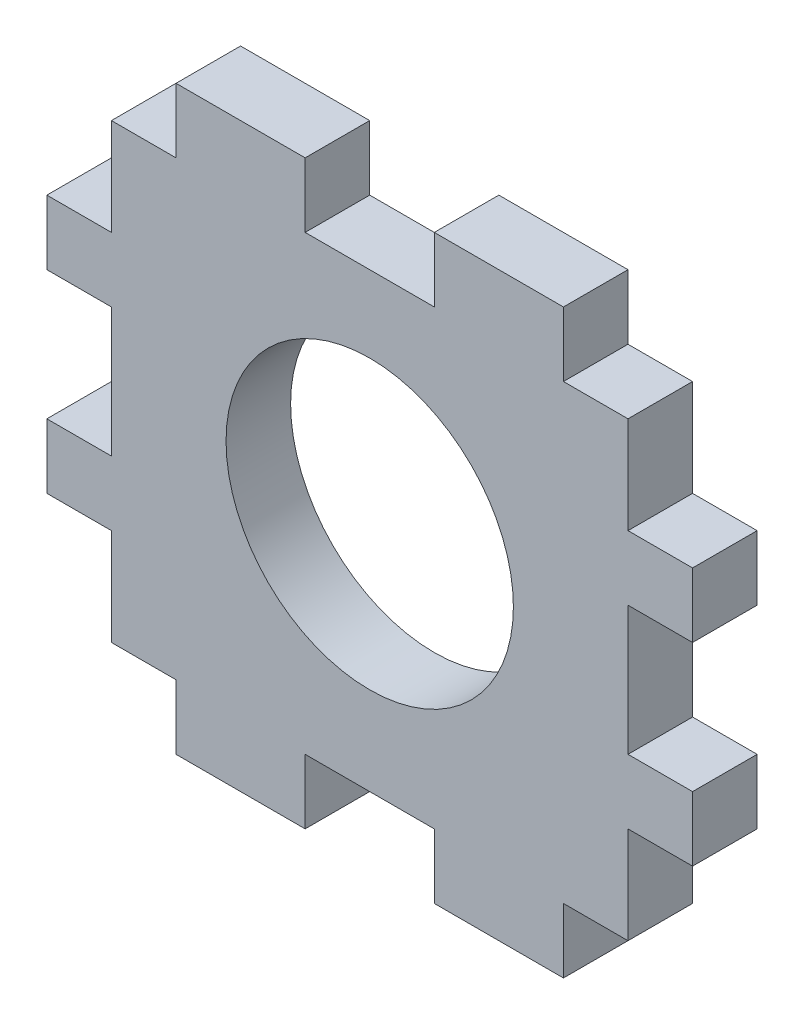
from build123d import *

# Parameters (mm, degrees)
MODEL_R         = 4.45
EXTRUDE_1_DEPTH = 2


with BuildPart() as part:
    # Model → 凸台-拉伸1 (new body)
    with BuildSketch(Plane.XY):
        Polygon((1022.075950507, 566.466158611), (1022.075950507, 569.466158611), (1024.075950507, 569.466158611), (1024.075950507, 571.466158611), (1028.075950507, 571.466158611), (1028.075950507, 569.466158611), (1032.075950507, 569.466158611), (1032.075950507, 571.466158611), (1036.075950507, 571.466158611), (1036.075950507, 569.466158611), (1038.075950507, 569.466158611), (1038.075950507, 566.466158611), (1040.075950507, 566.466158611), (1040.075950507, 564.466158611), (1038.075950507, 564.466158611), (1038.075950507, 560.466158611), (1040.075950507, 560.466158611), (1040.075950507, 558.466158611), (1038.075950507, 558.466158611), (1038.075950507, 555.466158611), (1036.075950507, 555.466158611), (1036.075950507, 553.466158611), (1032.075950507, 553.466158611), (1032.075950507, 555.466158611), (1028.075950507, 555.466158611), (1028.075950507, 553.466158611), (1024.075950507, 553.466158611), (1024.075950507, 555.466158611), (1022.075950507, 555.466158611), (1022.075950507, 558.466158611), (1020.075950507, 558.466158611), (1020.075950507, 560.466158611), (1022.075950507, 560.466158611), (1022.075950507, 564.466158611), (1020.075950507, 564.466158611), (1020.075950507, 566.466158611), align=None)
        with Locations((1030.075950507, 562.645606237)):
            Circle(MODEL_R, mode=Mode.SUBTRACT)
    extrude(amount=EXTRUDE_1_DEPTH)


solid = part.part
